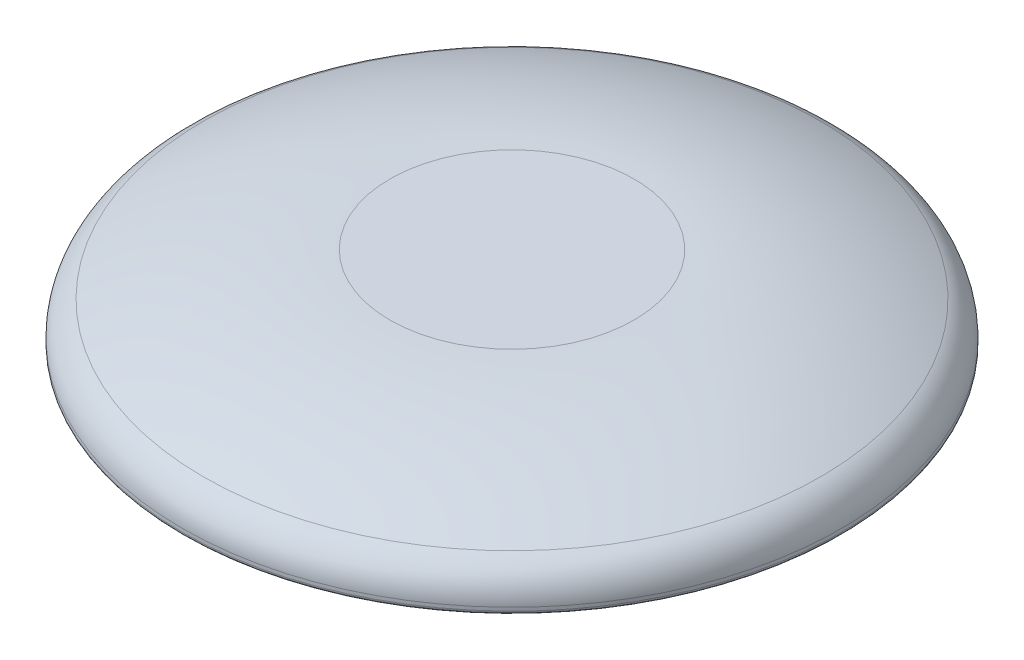
from build123d import *


with BuildPart() as part:
    # Sketch1 → Revolve1 (revolve)
    with BuildSketch(Plane(origin=(0, 0, 0), x_dir=(-1, 0, 0), z_dir=(0, 0, -1)), mode=Mode.PRIVATE) as revolve1_sk:
        with BuildLine():
            Line((-51.783358403, 30.734), (0, 30.734))
            Line((0, 30.734), (0, 35.56))
            Line((0, 35.56), (-51.783358403, 35.56))
            ThreePointArc((-51.783358403, 35.56), (-92.270582842, 30.960327151), (-130.694203117, 17.39575056))
            ThreePointArc((-130.694203117, 17.39575056), (-137.262977816, 11.492729559), (-139.7, 3.004185463))
            Line((-139.7, 3.004185463), (-139.7, 1.6002))
            ThreePointArc((-139.7, 1.6002), (-139.231312271, 0.468687729), (-138.0998, 0))
            Line((-138.0998, 0), (-136.4742, 0))
            ThreePointArc((-136.4742, 0), (-135.342687729, 0.468687729), (-134.874, 1.6002))
            Line((-134.874, 1.6002), (-134.874, 3.004185463))
            ThreePointArc((-134.874, 3.004185463), (-133.17195276, 8.932692451), (-128.584237098, 13.055437277))
            ThreePointArc((-128.584237098, 13.055437277), (-91.188010883, 26.257315993), (-51.783358403, 30.734))
        make_face()
    revolve(revolve1_sk.sketch.rotate(Axis((0, 0, 0), (0, 1, 0)), 270), axis=Axis((0, 0, 0), (0, 1, 0)))


solid = part.part
